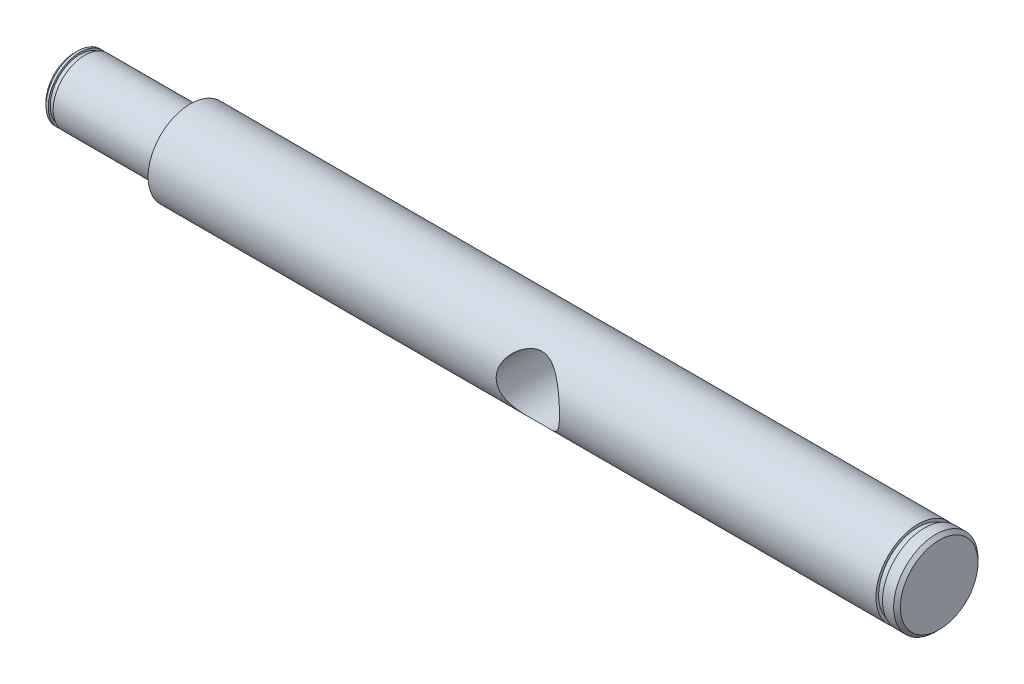
from build123d import *

# Parameters (mm, degrees)
CUT_EXTRUDE1_DEPTH      = 76.150982404
CUT_EXTRUDE1_DEPTH_BACK = 76.150982404
SKETCH2_R               = 4.7625
CHAMFER1_SIZE           = 0.508


with BuildPart() as part:
    # Sketch1 → Revolve1 (revolve)
    with BuildSketch(Plane.XY, mode=Mode.PRIVATE) as revolve1_sk:
        Polygon((-57.15, 6.35), (52.3875, 6.35), (52.3875, 5.9436), (53.3781, 5.9436), (53.3781, 6.35), (55.5625, 6.35), (55.5625, 0), (-74.6125, 0), (-74.6125, 4.7625), (-73.7616, 4.7625), (-73.7616, 4.4704), (-73.025, 4.4704), (-73.025, 4.7625), (-57.15, 4.7625), align=None)
    revolve(revolve1_sk.sketch.rotate(Axis((0, 0, 0), (-1, 0, 0)), 90), axis=Axis((0, 0, 0), (-1, 0, 0)))

    # Sketch2 → Cut-Extrude1 (cut, two sides: drawn at the far end of the back side and taken through both)
    with BuildSketch(Plane.XY.offset(-CUT_EXTRUDE1_DEPTH_BACK)):
        Circle(SKETCH2_R)
    extrude(amount=CUT_EXTRUDE1_DEPTH + CUT_EXTRUDE1_DEPTH_BACK, mode=Mode.SUBTRACT)

    # Chamfer1
    chamfer1_edges = [part.edges().sort_by_distance(p)[0] for p in [
        (-74.6125, 0, 4.7625),
        (55.5625, 0, 6.35),
    ]]
    chamfer(chamfer1_edges, length=CHAMFER1_SIZE)


solid = part.part
